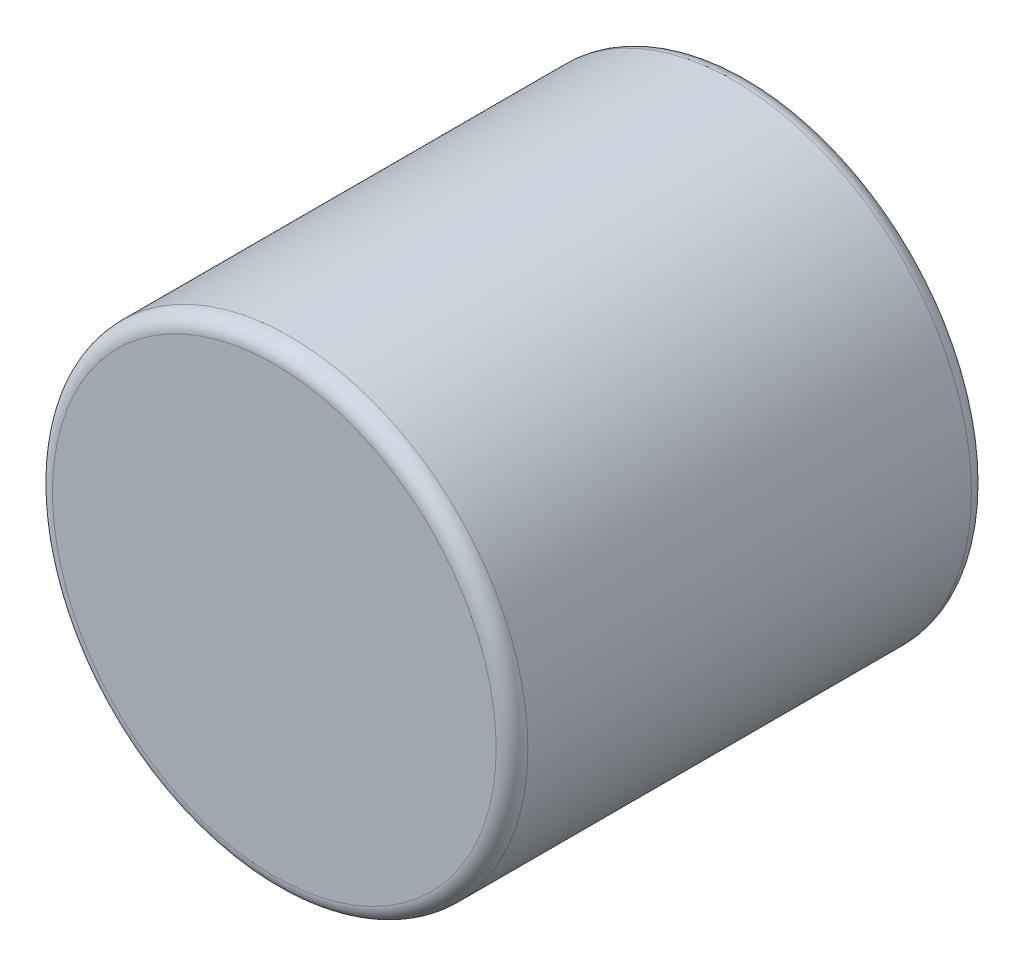
from build123d import *

# Parameters (mm, degrees)
SKETCH_1_R      = 15
EXTRUDE_1_DEPTH = 30
FILLET_1_R      = 1


with BuildPart() as part:
    # 草图1 → 凸台-拉伸1 (new body)
    with BuildSketch(Plane.XY):
        Circle(SKETCH_1_R)
    extrude(amount=EXTRUDE_1_DEPTH)

    # 圆角1
    fillet_1_edges = [part.edges().sort_by_distance(p)[0] for p in [
        (-15, 0, 0),
        (-15, 0, 30),
    ]]
    fillet(fillet_1_edges, radius=FILLET_1_R)

    # 草图2 → 切除-旋转1 (revolve, cut)
    with BuildSketch(Plane(origin=(0, 0, 0), x_dir=(1, 0, 0), z_dir=(0, 1, 0)), mode=Mode.PRIVATE) as cut_revolve_1_sk:
        with BuildLine():
            Line((0, 0), (3, 0))
            ThreePointArc((3, 0), (2.724744871, -0.866025404), (2, -1.414213562))
            ThreePointArc((2, -1.414213562), (1.642804036, -2.088628074), (1, -2.5))
            ThreePointArc((1, -2.5), (0.707106781, -1.792893219), (0, -1.5))
            Line((0, -1.5), (0, 0))
        make_face()
    revolve(cut_revolve_1_sk.sketch.rotate(Axis((0, 0, -2.778762471), (0, 0, 1)), 180), axis=Axis((0, 0, -2.778762471), (0, 0, 1)), mode=Mode.SUBTRACT)


solid = part.part
